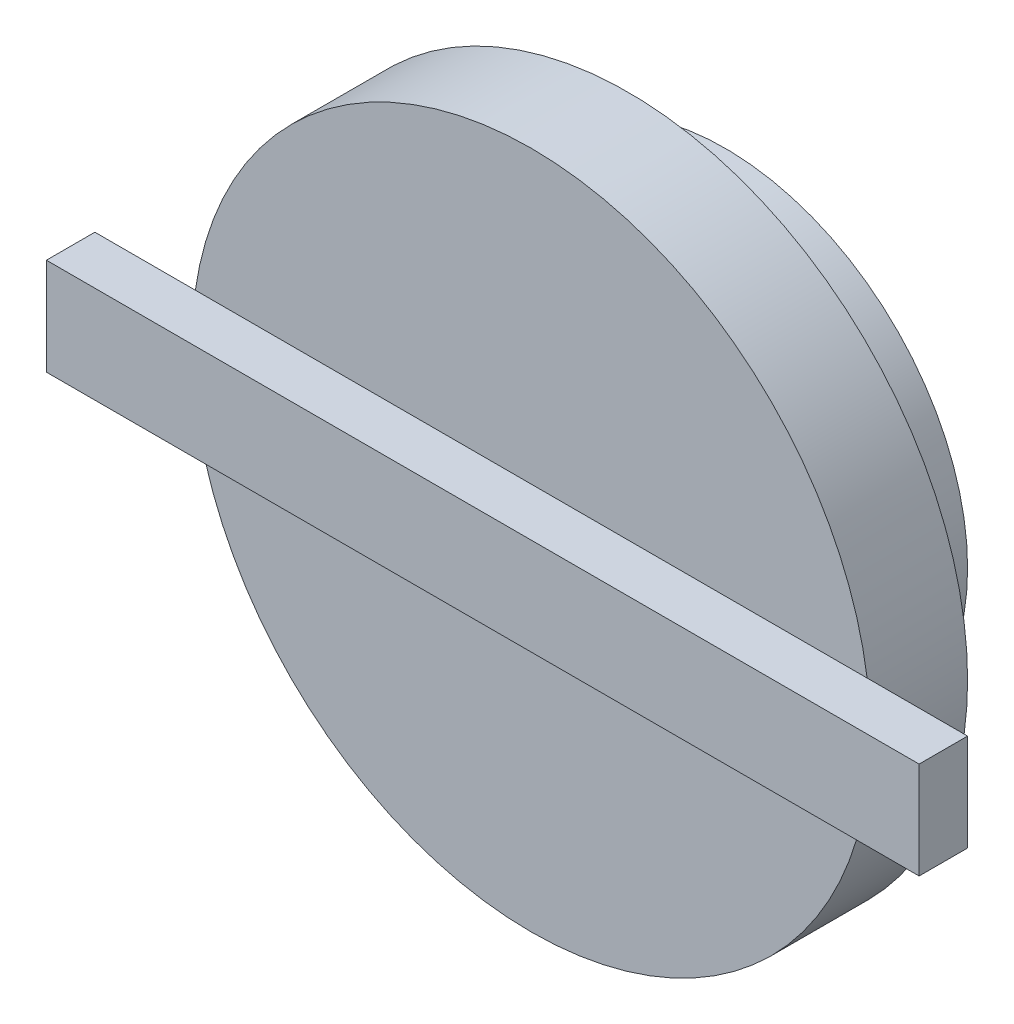
from build123d import *

# Parameters (mm, degrees)
SKETCH1_R           = 25
BOSS_EXTRUDE1_DEPTH = 10
SKETCH3_R           = 35
BOSS_EXTRUDE2_DEPTH = 10
SKETCH4_W           = 90
SKETCH4_H           = 10
BOSS_EXTRUDE3_DEPTH = 5


with BuildPart() as part:
    # Sketch1 → Boss-Extrude1 (new body)
    with BuildSketch(Plane.XY):
        Circle(SKETCH1_R)
    extrude(amount=BOSS_EXTRUDE1_DEPTH)

    # Sketch3 → Boss-Extrude2 (add)
    with BuildSketch(Plane.XY.offset(10)):
        Circle(SKETCH3_R)
    extrude(amount=BOSS_EXTRUDE2_DEPTH)

    # Sketch4 → Boss-Extrude3 (add)
    with BuildSketch(Plane.XY.offset(20)):
        Rectangle(SKETCH4_W, SKETCH4_H)
    extrude(amount=BOSS_EXTRUDE3_DEPTH)


solid = part.part
